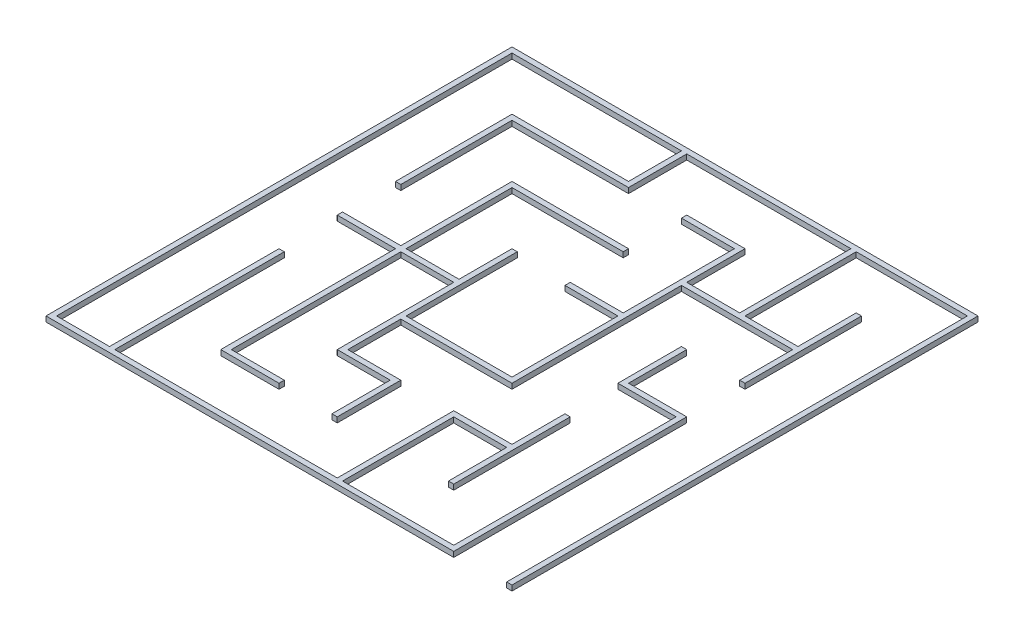
from build123d import *

# Parameters (mm, degrees)
BOSS_EXTRUDE1_DEPTH = 200


with BuildPart() as part:
    # Sketch1 → Boss-Extrude1 (new body)
    with BuildSketch(Plane(origin=(0, 0, 0), x_dir=(1, 0, 0), z_dir=(0, 1, 0))):
        Polygon((2200, -2200), (2200, 4200), (6400, 4200), (6400, 2200), (6600, 2200), (6600, 6600), (6400, 6600), (6400, 4400), (4400, 4400), (4400, 8600), (8600, 8600), (8600, -8800), (8800, -8800), (8800, 8800), (-8800, 8800), (-8800, -8800), (6600, -8800), (6600, 0), (4400, 0), (4400, 2200), (4200, 2200), (4200, -200), (6400, -200), (6400, -8600), (2200, -8600), (2200, -4400), (4200, -4400), (4200, -6600), (4400, -6600), (4400, -2200), (4200, -2200), (4200, -4200), (2000, -4200), (2000, -8600), (-6400, -8600), (-6400, -2200), (-6600, -2200), (-6600, -8600), (-8600, -8600), (-8600, 8600), (-2200, 8600), (-2200, 6600), (-6600, 6600), (-6600, 2200), (-6400, 2200), (-6400, 6400), (-2000, 6400), (-2000, 8600), (4200, 8600), (4200, 4400), (2200, 4400), (2200, 6600), (0, 6600), (0, 6400), (2000, 6400), (2000, 2200), (0, 2200), (0, 2000), (2000, 2000), (2000, -2000), (-2000, -2000), (-2000, 2200), (-2200, 2200), (-2200, 200), (-4200, 200), (-4200, 4200), (0, 4200), (0, 4400), (-4400, 4400), (-4400, 200), (-6600, 200), (-6600, 0), (-4400, 0), (-4400, -6600), (-2200, -6600), (-2200, -6400), (-4200, -6400), (-4200, 0), (-2200, 0), (-2200, -4400), (-200, -4400), (-200, -6600), (0, -6600), (0, -4200), (-2000, -4200), (-2000, -2200), align=None)
    extrude(amount=BOSS_EXTRUDE1_DEPTH)


solid = part.part
